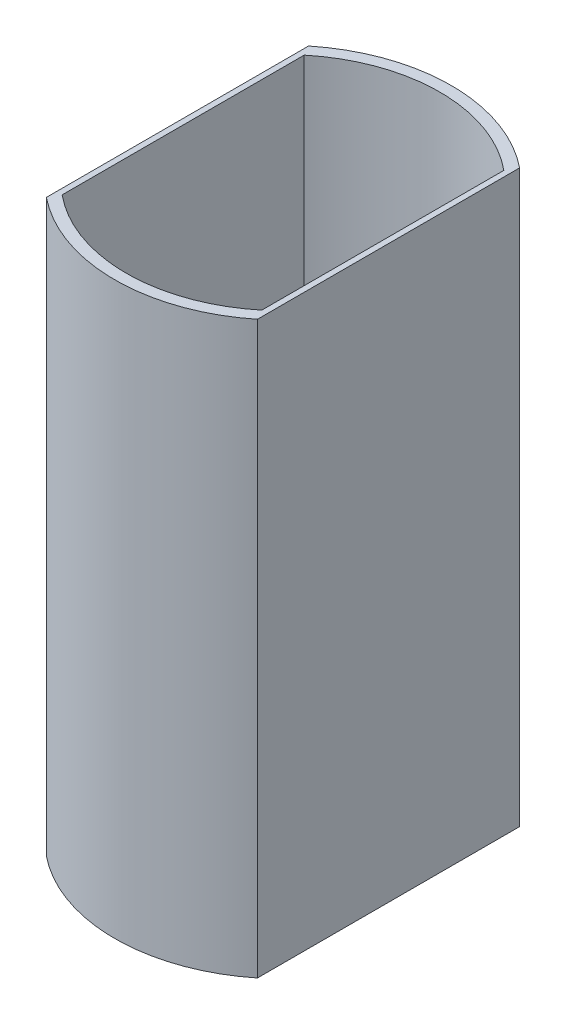
from build123d import *

# Parameters (mm, degrees)
EXTRUDE_1_DEPTH = 10


with BuildPart() as part:
    # Эскиз1 → Бобышка-Вытянуть1 (new body)
    with BuildSketch(Plane(origin=(0, 0, 0), x_dir=(1, 0, 0), z_dir=(0, 1, 0))):
        with BuildLine():
            Line((-1.85, 2.297825059), (-1.85, -2.297825059))
            ThreePointArc((-1.85, -2.297825059), (0, -2.95), (1.85, -2.297825059))
            Line((1.85, -2.297825059), (1.85, 2.297825059))
            ThreePointArc((1.85, 2.297825059), (0, 2.95), (-1.85, 2.297825059))
        make_face()
        with BuildLine():
            Line((-1.75, 2.121320344), (-1.75, -2.121320344))
            ThreePointArc((-1.75, -2.121320344), (0, -2.75), (1.75, -2.121320344))
            Line((1.75, -2.121320344), (1.75, 2.121320344))
            ThreePointArc((1.75, 2.121320344), (0, 2.75), (-1.75, 2.121320344))
        make_face(mode=Mode.SUBTRACT)
    extrude(amount=EXTRUDE_1_DEPTH)


solid = part.part
